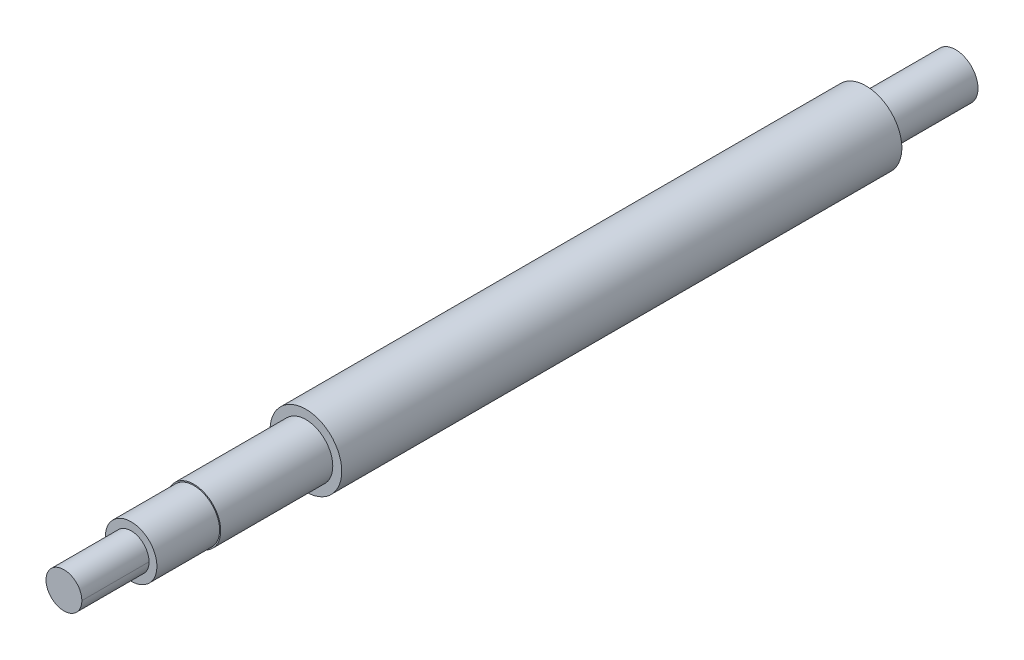
from build123d import *
from build123d.topology import SkipClean

# Parameters (mm, degrees)
SKETCH_1_R          = 5
EXTRUDE_1_DEPTH     = 10
SKETCH_2_R          = 8
EXTRUDE_2_DEPTH     = 135
SKETCH_3_R          = 6
EXTRUDE_3_DEPTH     = 25
SKETCH_4_R          = 5.75
EXTRUDE_4_DEPTH     = 14
SKETCH_5_R          = 4
EXTRUDE_5_DEPTH     = 15
SKETCH_6_R          = 8
SKETCH_6_R_2        = 5
CUT_EXTRUDE_1_DEPTH = 10


with BuildPart() as part:
    # 스케치1 → 보스-돌출1 (new body)
    with BuildSketch(Plane.XY):
        Circle(SKETCH_1_R)
    extrude(amount=EXTRUDE_1_DEPTH)

    # 스케치2 → 보스-돌출2 (add)
    with BuildSketch(Plane.XY.offset(10)):
        Circle(SKETCH_2_R)
    extrude(amount=EXTRUDE_2_DEPTH)

    # 스케치3 → 보스-돌출3 (add)
    with BuildSketch(Plane.XY.offset(145)):
        Circle(SKETCH_3_R)
    extrude(amount=EXTRUDE_3_DEPTH)

    # 스케치4 → 보스-돌출4 (add)
    with BuildSketch(Plane.XY.offset(170)):
        Circle(SKETCH_4_R)
    extrude(amount=EXTRUDE_4_DEPTH)

    # 스케치5 → 보스-돌출5 (add)
    with BuildSketch(Plane.XY.offset(184)):
        Circle(SKETCH_5_R)
    extrude(amount=EXTRUDE_5_DEPTH)

    # 스케치6 → 컷-돌출1 (cut)
    with SkipClean():  # the faces are left unmerged after this step: merging them gives an invalid solid
        with BuildSketch(Plane(origin=(0, 0, 10), x_dir=(-1, 0, 0), z_dir=(0, 0, -1))):
            Circle(SKETCH_6_R)
            Circle(SKETCH_6_R_2, mode=Mode.SUBTRACT)
        extrude(amount=-CUT_EXTRUDE_1_DEPTH, mode=Mode.SUBTRACT)


solid = part.part
